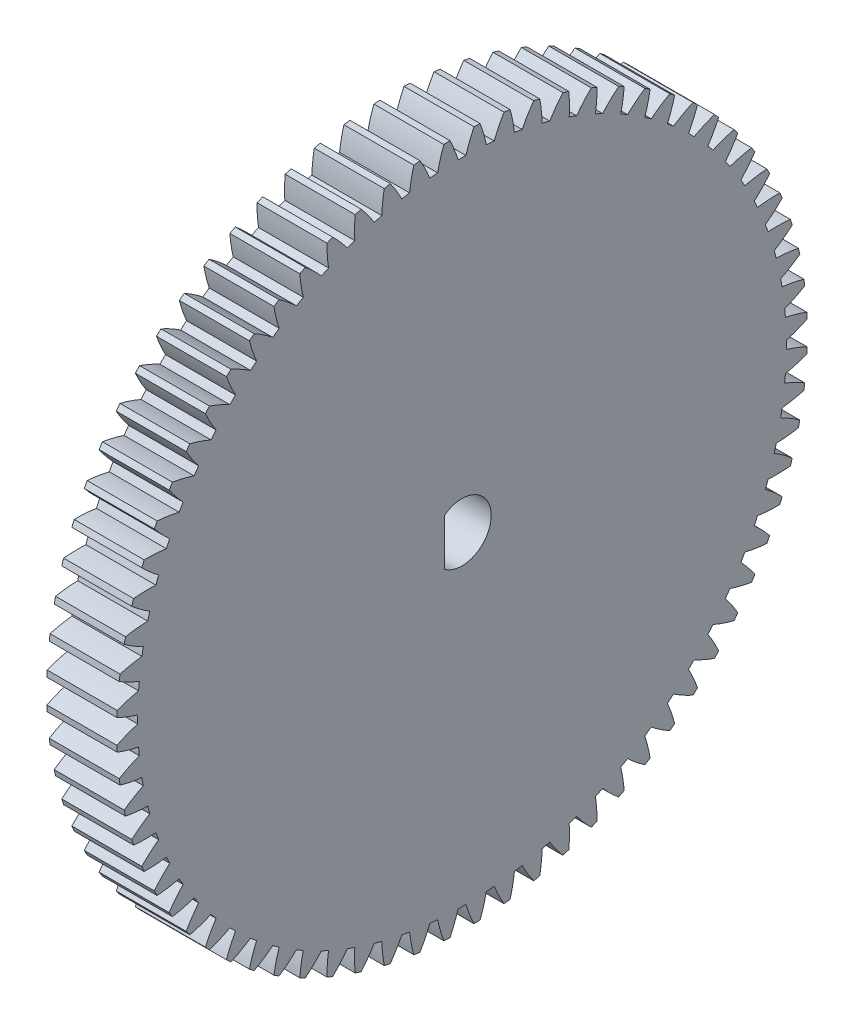
from build123d import *

# Parameters (mm, degrees)
BASPROSKE_W         = 6
BASPROSKE_H         = 29.6
TOOTHCUT_DEPTH      = 43.288532725
TEETHCUTS_COUNT     = 72
TEETHCUTS_ANGLE     = 355
BORSKE_R            = 2.5
BORE_DEPTH          = 50.0001524
BOSS_EXTRUDE1_DEPTH = 6


with BuildPart() as part:
    # BasProSke → Base-Revolve (revolve)
    with BuildSketch(Plane(origin=(0, 0, 0), x_dir=(1, 0, 0), z_dir=(0, 1, 0)), mode=Mode.PRIVATE) as base_revolve_sk:
        with Locations((3, 14.8)):
            Rectangle(BASPROSKE_W, BASPROSKE_H)
    revolve(base_revolve_sk.sketch.rotate(Axis((-10, 0, 0), (1, 0, 0)), 180), axis=Axis((-10, 0, 0), (1, 0, 0)))

    # TooCutSke → ToothCut (cut, through all)
    with BuildSketch(Plane(origin=(0, 0, 0), x_dir=(0, 0, -1), z_dir=(1, 0, 0))):
        with BuildLine():
            ThreePointArc((0.338290296, 27.796941571), (0, 27.799), (-0.338290296, 27.796941571))
            ThreePointArc((-0.338290296, 27.796941571), (-0.651320013, 28.71685386), (-1.04076178, 29.607112998))
            ThreePointArc((-1.04076178, 29.607112998), (0, 29.6254), (1.04076178, 29.607112998))
            ThreePointArc((1.04076178, 29.607112998), (0.651320013, 28.71685386), (0.338290296, 27.796941571))
        make_face()
    toothcut = extrude(amount=TOOTHCUT_DEPTH, mode=Mode.SUBTRACT)

    # TeethCuts: ToothCut ×72 about axis
    teethcuts_axis = Axis((-10, 0, 0), (1, 0, 0))
    for i in range(1, TEETHCUTS_COUNT):
        add(toothcut.rotate(teethcuts_axis, i * TEETHCUTS_ANGLE / (TEETHCUTS_COUNT - 1)), mode=Mode.SUBTRACT)

    # BorSke → Bore (cut, symmetric)
    with BuildSketch(Plane(origin=(0, 0, 0), x_dir=(0, 0, -1), z_dir=(1, 0, 0))):
        with Locations(Location((0, 0, 0), (0, 0, 180))):
            Circle(BORSKE_R)
    extrude(amount=BORE_DEPTH, both=True, mode=Mode.SUBTRACT)

    # Sketch1 → Boss-Extrude1 (add)
    with BuildSketch(Plane(origin=(6, 0, 0), x_dir=(0, 0, -1), z_dir=(1, 0, 0))):
        with BuildLine():
            ThreePointArc((-1.5, 2), (-2.236067977, 1.118033989), (-2.5, 0))
            Line((-2.5, 0), (-1.5, 0))
            Line((-1.5, 0), (-1.5, 2))
        make_face()
        with BuildLine():
            Line((-1.5, 0), (-2.5, 0))
            ThreePointArc((-2.5, 0), (-2.236067977, -1.118033989), (-1.5, -2))
            Line((-1.5, -2), (-1.5, 0))
        make_face()
    extrude(amount=-BOSS_EXTRUDE1_DEPTH)


solid = part.part
